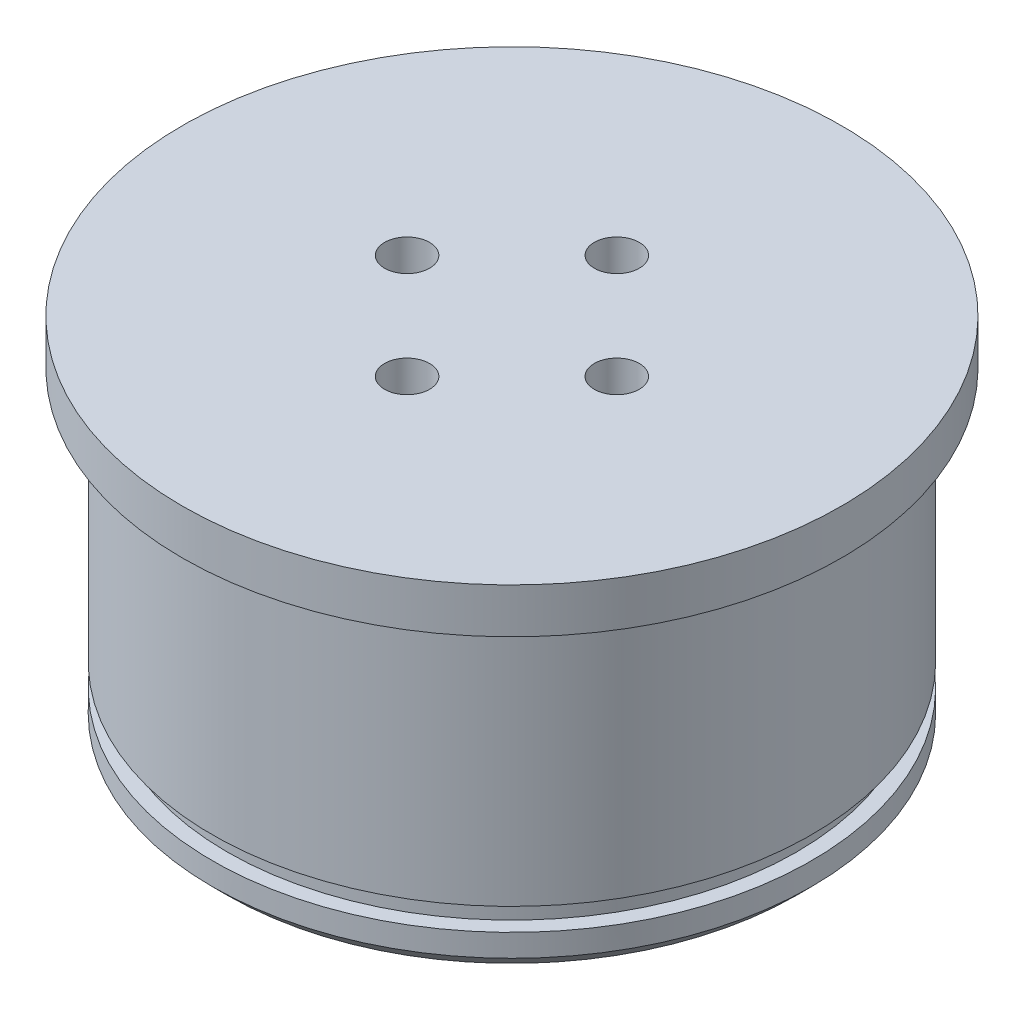
from build123d import *

# Parameters (mm, degrees)
SKETCH_1_R               = 20
EXTRUDE_1_DEPTH          = 21
SKETCH_2_R               = 10
CUT_EXTRUDE_2_DEPTH      = 2.5
SKETCH_5_R               = 20
SKETCH_5_R_2             = 19
CUT_EXTRUDE_5_DEPTH      = 1.5
CHAMFER_1_SIZE           = 1
SKETCH_6_R               = 22
EXTRUDE_2_DEPTH          = 3
SKETCH_4_R               = 1.5
CUT_EXTRUDE_6_DEPTH      = 38.818646195
PATTERN_CIRCULAR_1_COUNT = 4


with BuildPart() as part:
    # Эскиз1 → Бобышка-Вытянуть1 (new body)
    with BuildSketch(Plane(origin=(0, 0, 0), x_dir=(1, 0, 0), z_dir=(0, 1, 0))):
        with Locations(Location((0, 0, 0), (0, 0, 90))):
            Circle(SKETCH_1_R)
    extrude(amount=EXTRUDE_1_DEPTH)

    # Эскиз2 → Вырез-Вытянуть2 (cut)
    with BuildSketch(Plane.XZ):
        with Locations(Location((0, 0, 0), (0, 0, 270))):
            Circle(SKETCH_2_R)
    extrude(amount=-CUT_EXTRUDE_2_DEPTH, mode=Mode.SUBTRACT)

    # Эскиз5 → Вырез-Вытянуть5 (cut)
    with BuildSketch(Plane(origin=(0, 2.5, 0), x_dir=(-1, 0, 0), z_dir=(0, -1, 0))):
        with Locations(Location((0, 0, 0), (0, 0, 90))):
            Circle(SKETCH_5_R)
        with Locations(Location((0, 0, 0), (0, 0, 90))):
            Circle(SKETCH_5_R_2, mode=Mode.SUBTRACT)
    extrude(amount=-CUT_EXTRUDE_5_DEPTH, mode=Mode.SUBTRACT)

    # Фаска1
    chamfer_1_edges = [part.edges().sort_by_distance(p)[0] for p in [
        (0, 0, 20),
    ]]
    chamfer(chamfer_1_edges, length=CHAMFER_1_SIZE)

    # Эскиз6 → Бобышка-Вытянуть2 (add)
    with BuildSketch(Plane(origin=(0, 21, 0), x_dir=(1, 0, 0), z_dir=(0, 1, 0))):
        with Locations(Location((0, 0, 0), (0, 0, 270))):
            Circle(SKETCH_6_R)
    extrude(amount=EXTRUDE_2_DEPTH)

    # Эскиз4 → Вырез-Вытянуть6 (cut, through all)
    with BuildSketch(Plane.XZ.offset(-2.5)):
        with Locations(Location((0, 7, 0), (0, 0, 270))):
            Circle(SKETCH_4_R)
    cut_extrude_6 = extrude(amount=-CUT_EXTRUDE_6_DEPTH, mode=Mode.SUBTRACT)

    # Круговой массив1: Вырез-Вытянуть6 ×4 about axis
    pattern_circular_1_axis = Axis((0, 0, 0), (0, 1, 0))
    for i in range(1, PATTERN_CIRCULAR_1_COUNT):
        add(cut_extrude_6.rotate(pattern_circular_1_axis, i * 360 / PATTERN_CIRCULAR_1_COUNT), mode=Mode.SUBTRACT)


solid = part.part
